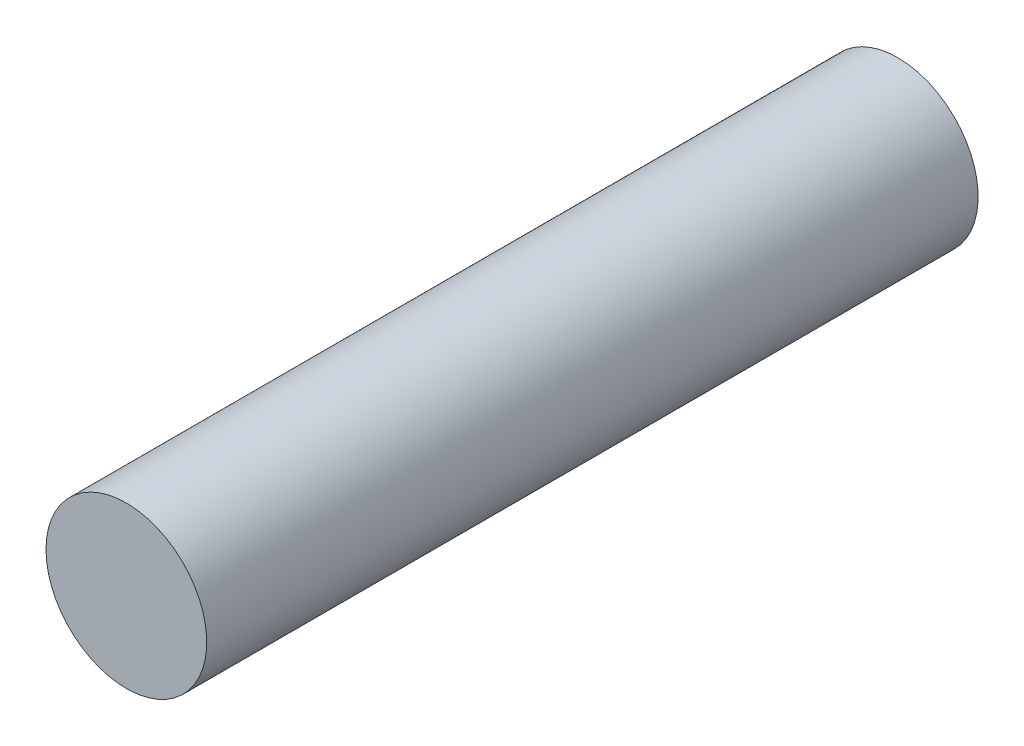
from build123d import *

# Parameters (mm, degrees)
SKETCH1_R           = 7.9375
BOSS_EXTRUDE1_DEPTH = 76.2


with BuildPart() as part:
    # Sketch1 → Boss-Extrude1 (new body)
    with BuildSketch(Plane.XY):
        with Locations(Location((0, 0, 0), (0, 0, 180))):
            Circle(SKETCH1_R)
    extrude(amount=BOSS_EXTRUDE1_DEPTH)


solid = part.part
